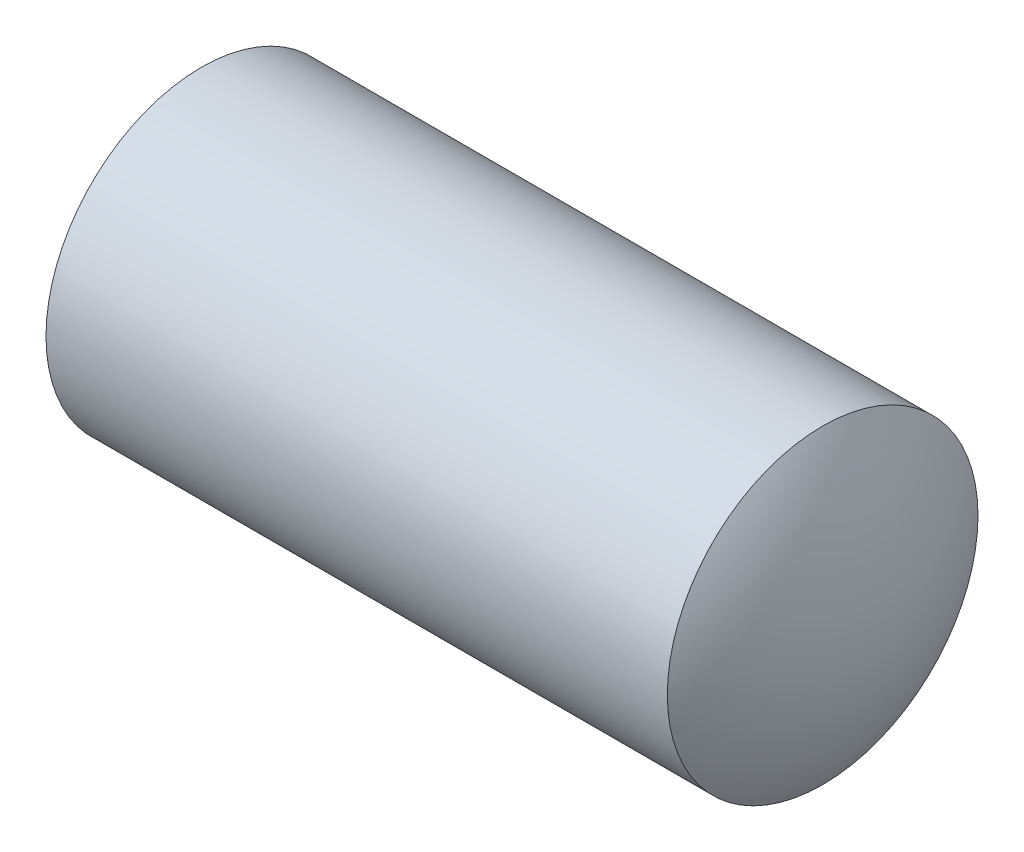
from build123d import *


with BuildPart() as part:
    # Sketch1 → Revolve1 (revolve)
    with BuildSketch(Plane.XY):
        with BuildLine():
            Line((0, 0), (0.3, 0))
            Line((0.3, 0), (4.3, 0))
            Line((4.3, 0), (4.6, 0))
            ThreePointArc((4.6, 0), (4.523384418, 0.522015325), (4.3, 1))
            Line((4.3, 1), (0.3, 1))
            ThreePointArc((0.3, 1), (0.076615582, 0.522015325), (0, 0))
        make_face()
    revolve(axis=Axis((0.3, 0, 0), (1, 0, 0)))


solid = part.part
